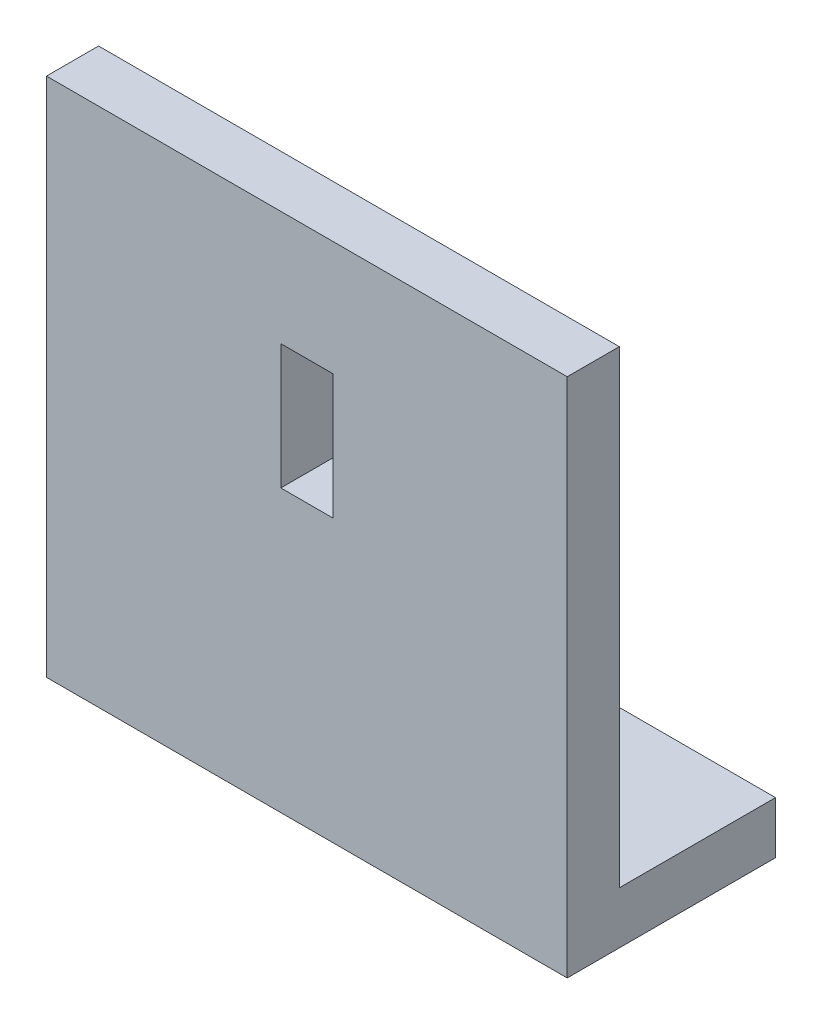
from build123d import *

# Parameters (mm, degrees)
SKETCH3_W           = 100
SKETCH3_H           = 40
BOSS_EXTRUDE1_DEPTH = 10
SKETCH4_W           = 100
SKETCH4_H           = 10
BOSS_EXTRUDE2_DEPTH = 90
SKETCH5_R           = 2
CUT_EXTRUDE1_DEPTH  = 90
SKETCH7_W           = 10
SKETCH7_H           = 12
CUT_EXTRUDE3_DEPTH  = 10
BOSS_EXTRUDE3_DEPTH = 23
SKETCH9_W           = 10
SKETCH9_H           = 2
BOSS_EXTRUDE5_DEPTH = 12
SKETCH12_W          = 2
SKETCH12_H          = 7
CUT_EXTRUDE6_DEPTH  = 12
SKETCH13_W          = 10
SKETCH13_H          = 12
CUT_EXTRUDE7_DEPTH  = 10


with BuildPart() as part:
    # Sketch3 → Boss-Extrude1 (new body)
    with BuildSketch(Plane(origin=(0, 0, 0), x_dir=(1, 0, 0), z_dir=(0, 1, 0))):
        Rectangle(SKETCH3_W, SKETCH3_H)
    extrude(amount=BOSS_EXTRUDE1_DEPTH)

    # Sketch4 → Boss-Extrude2 (add)
    with BuildSketch(Plane(origin=(0, 10, 0), x_dir=(1, 0, 0), z_dir=(0, 1, 0))):
        with Locations((0, -15)):
            Rectangle(SKETCH4_W, SKETCH4_H)
    extrude(amount=BOSS_EXTRUDE2_DEPTH)

    # Sketch5 → Cut-Extrude1 (cut)
    with BuildSketch(Plane(origin=(0, 10, 0), x_dir=(1, 0, 0), z_dir=(0, 1, 0))):
        with Locations(Location((-25, 5, 0), (0, 0, 270))):
            Circle(SKETCH5_R)
        with Locations(Location((25, 5, 0), (0, 0, 270))):
            Circle(SKETCH5_R)
    extrude(amount=-CUT_EXTRUDE1_DEPTH, mode=Mode.SUBTRACT)

    # Sketch7 → Cut-Extrude3 (cut)
    with BuildSketch(Plane(origin=(0, 0, 10), x_dir=(-1, 0, 0), z_dir=(0, 0, -1))):
        with Locations((0, 60)):
            Rectangle(SKETCH7_W, SKETCH7_H)
    extrude(amount=-CUT_EXTRUDE3_DEPTH, mode=Mode.SUBTRACT)

    # Sketch8 → Boss-Extrude3 (add)
    with BuildSketch(Plane(origin=(0, 0, 10), x_dir=(-1, 0, 0), z_dir=(0, 0, -1))):
        Polygon((-5, 54), (-5, 66), (-7, 66), (-7, 52), (7, 52), (7, 66), (5, 66), (5, 54), align=None)
    extrude(amount=BOSS_EXTRUDE3_DEPTH)

    # Sketch9 → Boss-Extrude5 (add)
    with BuildSketch(Plane(origin=(0, 54, 0), x_dir=(1, 0, 0), z_dir=(0, 1, 0))):
        with Locations((0, 12)):
            Rectangle(SKETCH9_W, SKETCH9_H)
    extrude(amount=BOSS_EXTRUDE5_DEPTH)

    # Sketch12 → Cut-Extrude6 (cut)
    with BuildSketch(Plane(origin=(0, 66, 0), x_dir=(1, 0, 0), z_dir=(0, 1, 0))):
        with Locations((-6, 7.5)):
            Rectangle(SKETCH12_W, SKETCH12_H)
    extrude(amount=-CUT_EXTRUDE6_DEPTH, mode=Mode.SUBTRACT)

    # Sketch13 → Cut-Extrude7 (cut)
    with BuildSketch(Plane(origin=(0, 0, 10), x_dir=(-1, 0, 0), z_dir=(0, 0, -1))):
        with Locations((0, 72)):
            Rectangle(SKETCH13_W, SKETCH13_H)
    extrude(amount=-CUT_EXTRUDE7_DEPTH, mode=Mode.SUBTRACT)


solid = part.part
